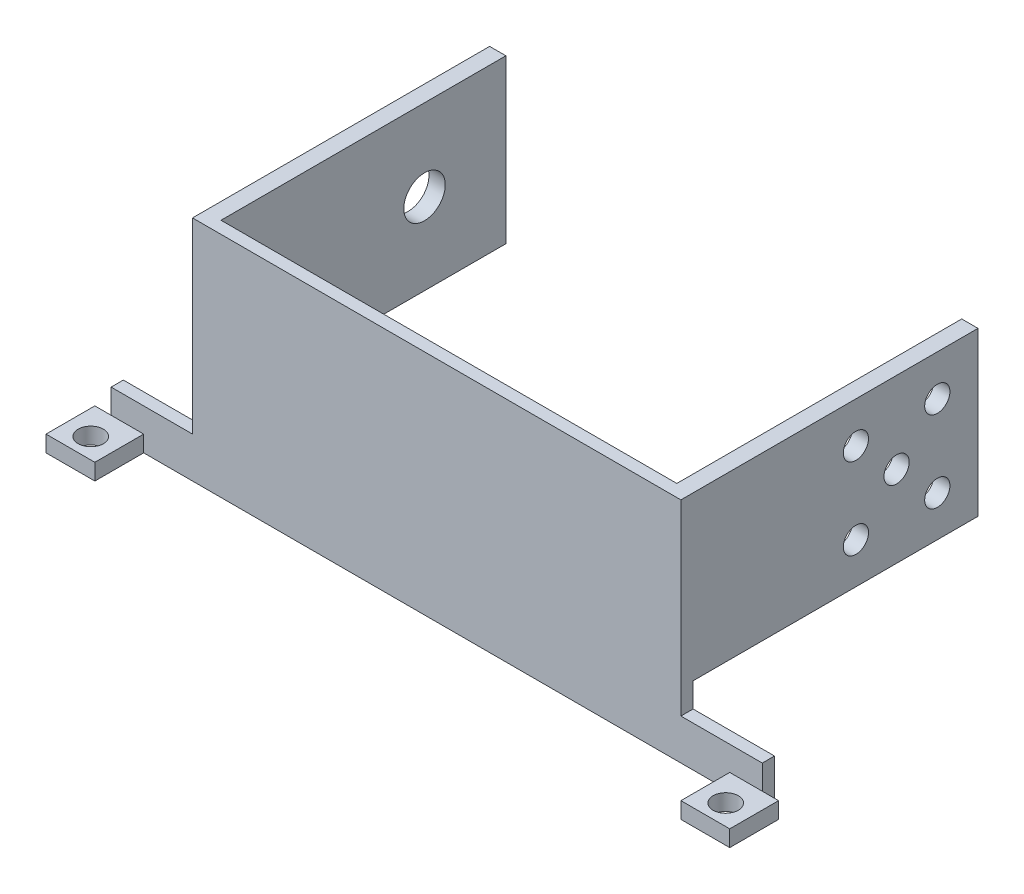
from build123d import *

# Parameters (mm, degrees)
EXTRUDE_1_DEPTH     = 1.5
EXTRUDE_2_DEPTH     = 1.5
SKETCH_3_W          = 6
SKETCH_3_H          = 2
EXTRUDE_3_DEPTH     = 6
SKETCH_4_R          = 1.55
CUT_EXTRUDE_1_DEPTH = 4.5
SKETCH_5_W          = 2
SKETCH_5_H          = 20
EXTRUDE_4_DEPTH     = 35
SKETCH_6_R          = 1.55
CUT_EXTRUDE_2_DEPTH = 35
SKETCH_7_R          = 2.55
CUT_EXTRUDE_4_DEPTH = 35


with BuildPart() as part:
    # 草图1 → 凸台-拉伸1 (new body)
    with BuildSketch(Plane.XY):
        Polygon((-30, 12), (-30, -12), (30, -12), (30, 12), (30, 16), (-30, 16), align=None)
    extrude(amount=EXTRUDE_1_DEPTH)

    # 草图2 → 凸台-拉伸2 (add)
    with BuildSketch(Plane.XY.offset(1.5)):
        Polygon((-40, -7), (-30, -7), (-27, -7), (-27, -12), (-30, -12), (-40, -12), align=None)
        Polygon((40, -7), (40, -12), (30, -12), (27, -12), (27, -7), (30, -7), align=None)
    extrude(amount=-EXTRUDE_2_DEPTH)

    # 草图3 → 凸台-拉伸3 (add)
    with BuildSketch(Plane.XY.offset(1.5)):
        with Locations((39, -11)):
            Rectangle(SKETCH_3_W, SKETCH_3_H)
        with Locations((-39, -11)):
            Rectangle(SKETCH_3_W, SKETCH_3_H)
    extrude(amount=EXTRUDE_3_DEPTH)

    # 草图4 → 切除-拉伸1 (cut)
    with BuildSketch(Plane.XZ.offset(12)):
        with Locations(Location((39, 5, 0), (0, 0, 270))):
            Circle(SKETCH_4_R)
        with Locations(Location((-39, 5, 0), (0, 0, 270))):
            Circle(SKETCH_4_R)
    extrude(amount=-CUT_EXTRUDE_1_DEPTH, mode=Mode.SUBTRACT)

    # 草图5 → 凸台-拉伸4 (add)
    with BuildSketch(Plane(origin=(0, 0, 0), x_dir=(-1, 0, 0), z_dir=(0, 0, -1))):
        with Locations((29, 6)):
            Rectangle(SKETCH_5_W, SKETCH_5_H)
        with Locations((-29, 6)):
            Rectangle(SKETCH_5_W, SKETCH_5_H)
    extrude(amount=EXTRUDE_4_DEPTH)

    # 草图6 → 切除-拉伸2 (cut)
    with BuildSketch(Plane(origin=(30, 0, 0), x_dir=(0, 0, -1), z_dir=(1, 0, 0))):
        with Locations((25, 6)):
            Circle(SKETCH_6_R)
        with Locations((30, 11)):
            Circle(SKETCH_6_R)
        with Locations(Location((30, 1, 0), (0, 0, 90))):
            Circle(SKETCH_6_R)
        with Locations(Location((20, 1, 0), (0, 0, 90))):
            Circle(SKETCH_6_R)
        with Locations((20, 11)):
            Circle(SKETCH_6_R)
    extrude(amount=-CUT_EXTRUDE_2_DEPTH, mode=Mode.SUBTRACT)

    # 草图7 → 切除-拉伸4 (cut)
    with BuildSketch(Plane.ZY.offset(30)):
        with Locations(Location((-25, 6, 0), (0, 0, 270))):
            Circle(SKETCH_7_R)
    extrude(amount=-CUT_EXTRUDE_4_DEPTH, mode=Mode.SUBTRACT)


solid = part.part
